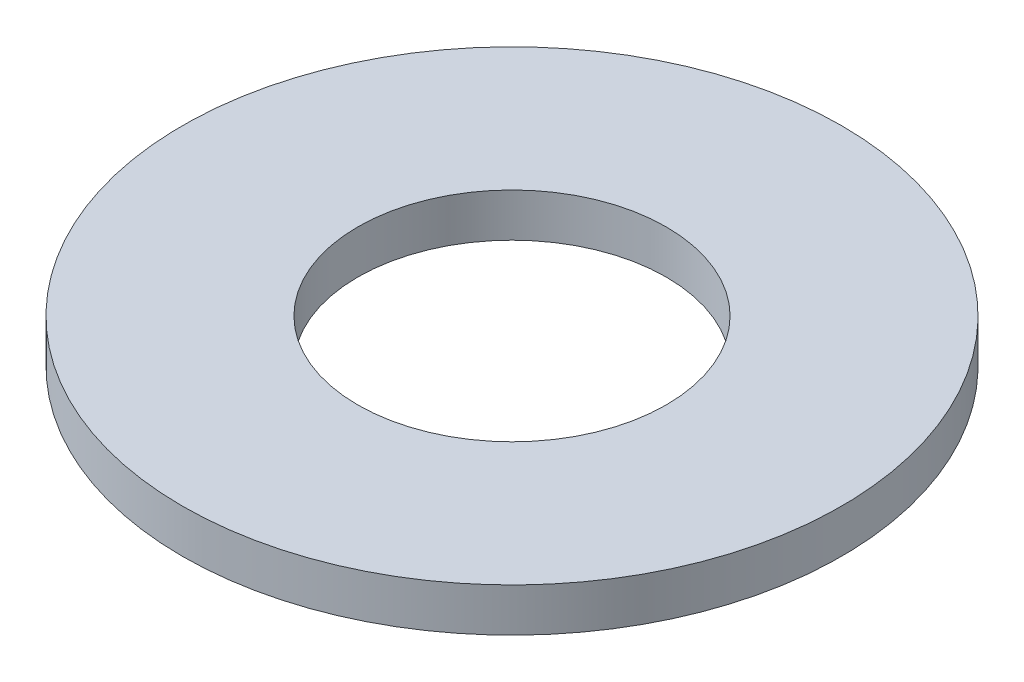
from build123d import *

# Parameters (mm, degrees)
SKETCH1_R           = 6.35
BOSS_EXTRUDE1_DEPTH = 0.8382
SKETCH5_R           = 2.9718
CUT_EXTRUDE1_DEPTH  = 10.019289287


with BuildPart() as part:
    # Sketch1 → Boss-Extrude1 (new body)
    with BuildSketch(Plane(origin=(0, 0, 0), x_dir=(1, 0, 0), z_dir=(0, 1, 0))):
        with Locations(Location((0, 0, 0), (0, 0, 270))):
            Circle(SKETCH1_R)
    extrude(amount=BOSS_EXTRUDE1_DEPTH)

    # Sketch5 → Cut-Extrude1 (cut, through all)
    with BuildSketch(Plane(origin=(0, 0.8382, 0), x_dir=(-1, 0, 0), z_dir=(0, 1, 0))):
        with Locations(Location((0, 0, 0), (0, 0, 90))):
            Circle(SKETCH5_R)
    extrude(amount=-CUT_EXTRUDE1_DEPTH, mode=Mode.SUBTRACT)


solid = part.part
